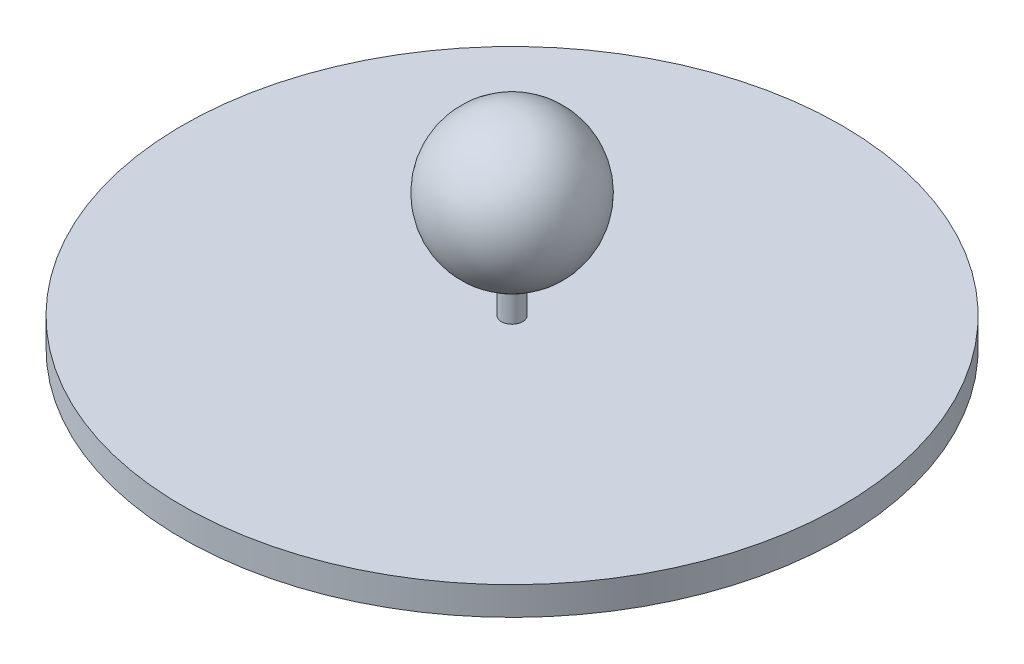
from build123d import *


with BuildPart() as part:
    # 草图1 → 旋转1 (revolve)
    with BuildSketch(Plane.XY, mode=Mode.PRIVATE) as revolve_1_sk:
        with BuildLine():
            Line((0, 288.881257919), (0, 0))
            Line((0, 0), (20, 0))
            Line((20, 0), (20, 100))
            Line((20, 100), (15, 100))
            Line((15, 100), (15, 200))
            Line((15, 200), (465, 200))
            Line((465, 200), (465, 240))
            Line((465, 240), (15, 240))
            Line((15, 240), (15, 290))
            ThreePointArc((15, 290), (7.520830803, 289.161331306), (0, 288.881257919))
        make_face()
        with BuildLine():
            Line((0, 390), (0, 290))
            Line((0, 290), (15, 290))
            ThreePointArc((15, 290), (76.6217369, 324.014324021), (101.118742081, 390))
            ThreePointArc((101.118742081, 390), (71.50174823, 461.50174823), (0, 491.118742081))
            Line((0, 491.118742081), (0, 390))
        make_face()
        with BuildLine():
            Line((0, 290), (0, 288.881257919))
            ThreePointArc((0, 288.881257919), (7.520830803, 289.161331306), (15, 290))
            Line((15, 290), (0, 290))
        make_face()
    revolve(revolve_1_sk.sketch.rotate(Axis((0, 290, 0), (0, 1, 0)), 90), axis=Axis((0, 290, 0), (0, 1, 0)))


solid = part.part
